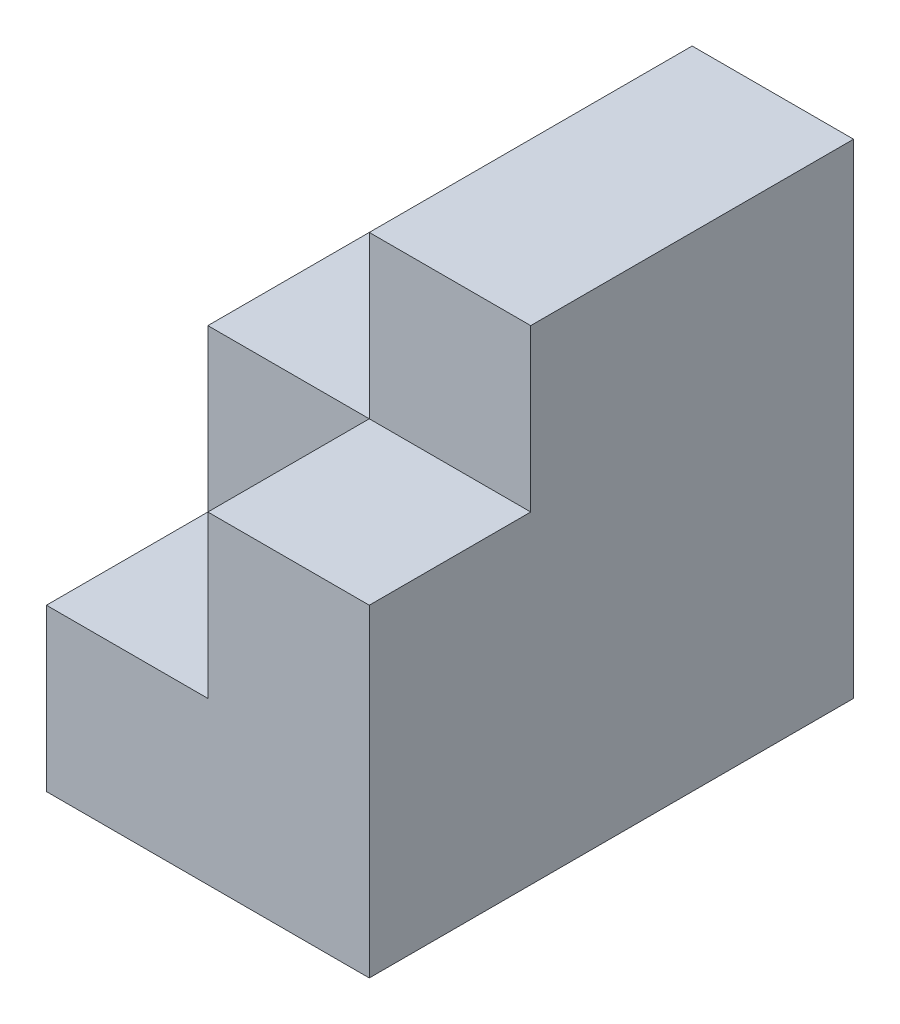
from build123d import *

# Parameters (mm, degrees)
ESBO_O1_W                = 60
ESBO_O1_H                = 20
RESSALTO_EXTRUS_O1_DEPTH = 20
ESBO_O2_W                = 40
ESBO_O2_H                = 20
RESSALTO_EXTRUS_O2_DEPTH = 40
ESBO_O3_W                = 20
ESBO_O3_H                = 60
RESSALTO_EXTRUS_O3_DEPTH = 20
ESBO_O4_W                = 20
ESBO_O4_H                = 40
RESSALTO_EXTRUS_O4_DEPTH = 20


with BuildPart() as part:
    # Esboço1 → Ressalto-extrusão1 (new body)
    with BuildSketch(Plane.XY):
        with Locations((30, 10)):
            Rectangle(ESBO_O1_W, ESBO_O1_H)
    extrude(amount=RESSALTO_EXTRUS_O1_DEPTH)

    # Esboço2 → Ressalto-extrusão2 (add)
    with BuildSketch(Plane.XY.offset(20)):
        with Locations((40, 10)):
            Rectangle(ESBO_O2_W, ESBO_O2_H)
    extrude(amount=RESSALTO_EXTRUS_O2_DEPTH)

    # Esboço3 → Ressalto-extrusão3 (add)
    with BuildSketch(Plane(origin=(0, 20, 0), x_dir=(1, 0, 0), z_dir=(0, 1, 0))):
        with Locations((50, -30)):
            Rectangle(ESBO_O3_W, ESBO_O3_H)
    extrude(amount=RESSALTO_EXTRUS_O3_DEPTH)

    # Esboço4 → Ressalto-extrusão4 (add)
    with BuildSketch(Plane(origin=(0, 40, 0), x_dir=(1, 0, 0), z_dir=(0, 1, 0))):
        with Locations((50, -20)):
            Rectangle(ESBO_O4_W, ESBO_O4_H)
    extrude(amount=RESSALTO_EXTRUS_O4_DEPTH)


solid = part.part
